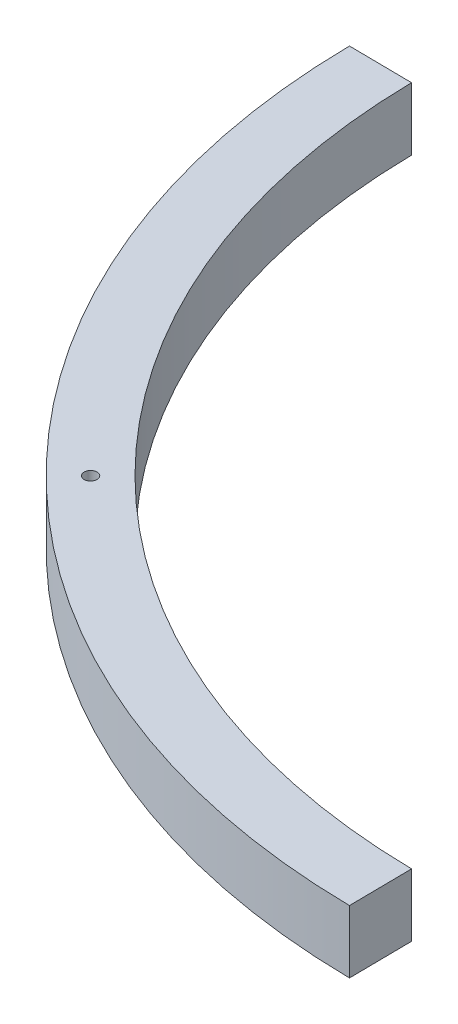
from build123d import *

# Parameters (mm, degrees)
SKETCH1_R           = 1.55
BOSS_EXTRUDE1_DEPTH = 15


with BuildPart() as part:
    # Sketch1 → Boss-Extrude1 (new body)
    with BuildSketch(Plane(origin=(0, 0, 0), x_dir=(1, 0, 0), z_dir=(0, 1, 0))):
        with BuildLine():
            Line((-90, 87.922824157), (-74.984658378, 87.75))
            ThreePointArc((-74.984658378, 87.75), (-26.673210325, -26.672027463), (87.748327336, -74.984635558))
            Line((87.748327336, -74.984635558), (87.922824157, -90))
            ThreePointArc((87.922824157, -90), (-37.287695123, -37.287695123), (-90, 87.922824157))
        make_face()
        with Locations(Location((-31.975919755, -31.975919755, 0), (0, 0, 270))):
            Circle(SKETCH1_R, mode=Mode.SUBTRACT)
    extrude(amount=BOSS_EXTRUDE1_DEPTH)


solid = part.part
